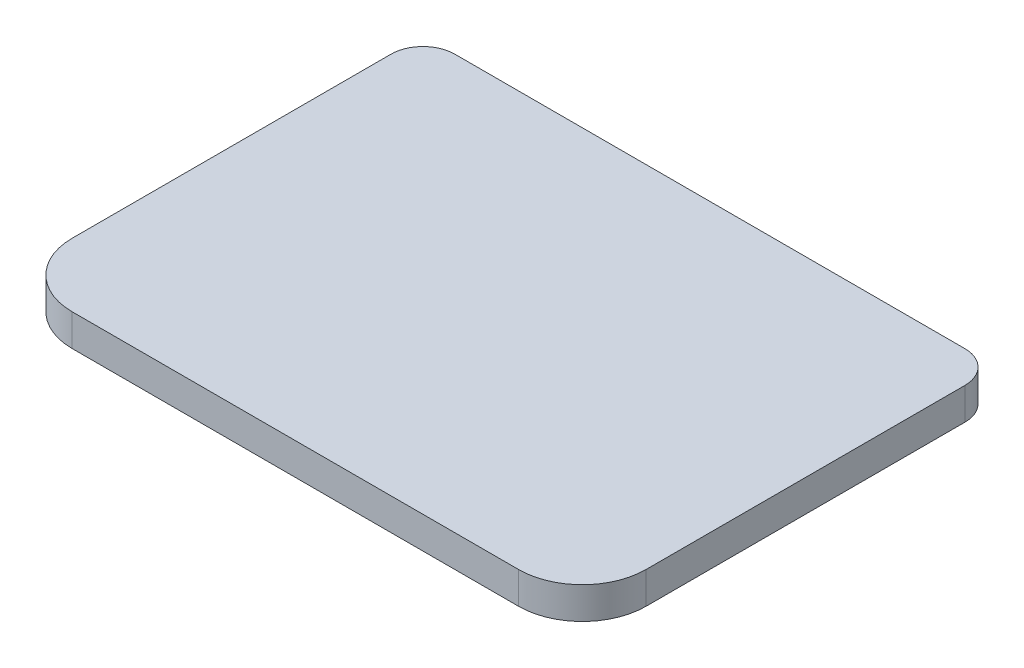
from build123d import *

# Parameters (mm, degrees)
SKETCH1_W           = 57.15
SKETCH1_H           = 41.275
BOSS_EXTRUDE1_DEPTH = 3.175
FILLET1_R           = 6.35
FILLET2_R           = 3.175


with BuildPart() as part:
    # Sketch1 → Boss-Extrude1 (new body)
    with BuildSketch(Plane(origin=(0, 0, 0), x_dir=(1, 0, 0), z_dir=(0, 1, 0))):
        Rectangle(SKETCH1_W, SKETCH1_H)
    extrude(amount=BOSS_EXTRUDE1_DEPTH)

    # Fillet1
    fillet1_edges = [part.edges().sort_by_distance(p)[0] for p in [
        (28.575, 1.5875, 20.6375),
        (-28.575, 1.5875, 20.6375),
    ]]
    fillet(fillet1_edges, radius=FILLET1_R)

    # Fillet2
    fillet2_edges = [part.edges().sort_by_distance(p)[0] for p in [
        (-28.575, 1.5875, -20.6375),
        (28.575, 1.5875, -20.6375),
    ]]
    fillet(fillet2_edges, radius=FILLET2_R)


solid = part.part
